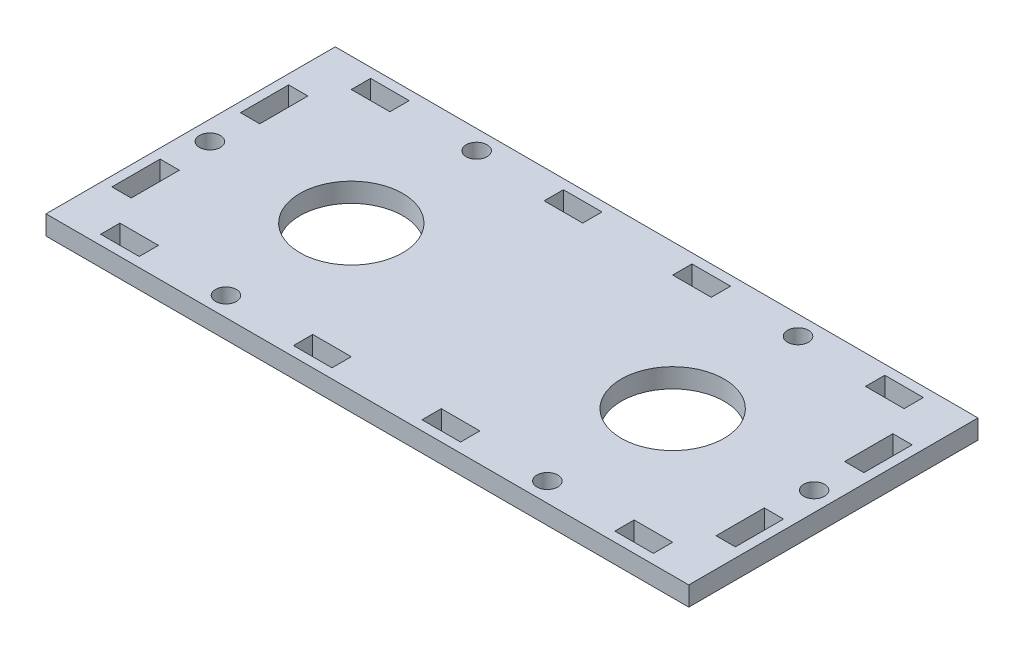
from build123d import *

# Parameters (mm, degrees)
SKETCH1_W           = 200
SKETCH1_H           = 90
BOSS_EXTRUDE1_DEPTH = 6
CUT_EXTRUDE1_REACH  = 111.823
SKETCH2_R           = 16
CUT_EXTRUDE2_REACH  = 111.823
SKETCH3_R           = 3.25
SKETCH3_W           = 12
SKETCH3_H           = 6
SKETCH3_W_2         = 6
SKETCH3_H_2         = 15


with BuildPart() as part:
    # Sketch1 → Boss-Extrude1 (new body)
    with BuildSketch(Plane(origin=(0, 0, 0), x_dir=(1, 0, 0), z_dir=(0, 1, 0))):
        Rectangle(SKETCH1_W, SKETCH1_H)
    extrude(amount=BOSS_EXTRUDE1_DEPTH)

    # Sketch2 → Cut-Extrude1 (cut, up to next)
    with BuildSketch(Plane(origin=(0, 6, 0), x_dir=(1, 0, 0), z_dir=(0, 1, 0)), mode=Mode.PRIVATE) as cut_extrude1_sk1:
        with Locations(Location((-50, 0, 0), (0, 0, 270))):
            Circle(SKETCH2_R)
    cut_extrude1_tool1 = extrude(cut_extrude1_sk1.sketch, amount=-CUT_EXTRUDE1_REACH, mode=Mode.PRIVATE) & part.part
    # Sketch2 → Cut-Extrude1 (cut, up to next)
    with BuildSketch(Plane(origin=(0, 6, 0), x_dir=(1, 0, 0), z_dir=(0, 1, 0)), mode=Mode.PRIVATE) as cut_extrude1_sk2:
        with Locations(Location((50, 0, 0), (0, 0, 270))):
            Circle(SKETCH2_R)
    cut_extrude1_tool2 = extrude(cut_extrude1_sk2.sketch, amount=-CUT_EXTRUDE1_REACH, mode=Mode.PRIVATE) & part.part
    add(cut_extrude1_tool1.solids().sort_by_distance((-50, 6, 0))[0], mode=Mode.SUBTRACT)
    add(cut_extrude1_tool2.solids().sort_by_distance((50, 6, 0))[0], mode=Mode.SUBTRACT)

    # Sketch3 → Cut-Extrude2 (cut, up to next)
    with BuildSketch(Plane(origin=(0, 6, 0), x_dir=(1, 0, 0), z_dir=(0, 1, 0)), mode=Mode.PRIVATE) as cut_extrude2_sk1:
        with Locations(Location((-50, 39, 0), (0, 0, 270))):
            Circle(SKETCH3_R)
    cut_extrude2_tool1 = extrude(cut_extrude2_sk1.sketch, amount=-CUT_EXTRUDE2_REACH, mode=Mode.PRIVATE) & part.part
    # Sketch3 → Cut-Extrude2 (cut, up to next)
    with BuildSketch(Plane(origin=(0, 6, 0), x_dir=(1, 0, 0), z_dir=(0, 1, 0)), mode=Mode.PRIVATE) as cut_extrude2_sk2:
        with Locations(Location((50, 39, 0), (0, 0, 270))):
            Circle(SKETCH3_R)
    cut_extrude2_tool2 = extrude(cut_extrude2_sk2.sketch, amount=-CUT_EXTRUDE2_REACH, mode=Mode.PRIVATE) & part.part
    # Sketch3 → Cut-Extrude2 (cut, up to next)
    with BuildSketch(Plane(origin=(0, 6, 0), x_dir=(1, 0, 0), z_dir=(0, 1, 0)), mode=Mode.PRIVATE) as cut_extrude2_sk3:
        with Locations(Location((50, -39, 0), (0, 0, 270))):
            Circle(SKETCH3_R)
    cut_extrude2_tool3 = extrude(cut_extrude2_sk3.sketch, amount=-CUT_EXTRUDE2_REACH, mode=Mode.PRIVATE) & part.part
    # Sketch3 → Cut-Extrude2 (cut, up to next)
    with BuildSketch(Plane(origin=(0, 6, 0), x_dir=(1, 0, 0), z_dir=(0, 1, 0)), mode=Mode.PRIVATE) as cut_extrude2_sk4:
        with Locations(Location((-50, -39, 0), (0, 0, 270))):
            Circle(SKETCH3_R)
    cut_extrude2_tool4 = extrude(cut_extrude2_sk4.sketch, amount=-CUT_EXTRUDE2_REACH, mode=Mode.PRIVATE) & part.part
    # Sketch3 → Cut-Extrude2 (cut, up to next)
    with BuildSketch(Plane(origin=(0, 6, 0), x_dir=(1, 0, 0), z_dir=(0, 1, 0)), mode=Mode.PRIVATE) as cut_extrude2_sk5:
        with Locations(Location((-94, 0, 0), (0, 0, 270))):
            Circle(SKETCH3_R)
    cut_extrude2_tool5 = extrude(cut_extrude2_sk5.sketch, amount=-CUT_EXTRUDE2_REACH, mode=Mode.PRIVATE) & part.part
    # Sketch3 → Cut-Extrude2 (cut, up to next)
    with BuildSketch(Plane(origin=(0, 6, 0), x_dir=(1, 0, 0), z_dir=(0, 1, 0)), mode=Mode.PRIVATE) as cut_extrude2_sk6:
        with Locations(Location((94, 0, 0), (0, 0, 270))):
            Circle(SKETCH3_R)
    cut_extrude2_tool6 = extrude(cut_extrude2_sk6.sketch, amount=-CUT_EXTRUDE2_REACH, mode=Mode.PRIVATE) & part.part
    # Sketch3 → Cut-Extrude2 (cut, up to next)
    with BuildSketch(Plane(origin=(0, 6, 0), x_dir=(1, 0, 0), z_dir=(0, 1, 0)), mode=Mode.PRIVATE) as cut_extrude2_sk7:
        with Locations((-80, 39)):
            Rectangle(SKETCH3_W, SKETCH3_H)
    cut_extrude2_tool7 = extrude(cut_extrude2_sk7.sketch, amount=-CUT_EXTRUDE2_REACH, mode=Mode.PRIVATE) & part.part
    # Sketch3 → Cut-Extrude2 (cut, up to next)
    with BuildSketch(Plane(origin=(0, 6, 0), x_dir=(1, 0, 0), z_dir=(0, 1, 0)), mode=Mode.PRIVATE) as cut_extrude2_sk8:
        with Locations((-20, 39)):
            Rectangle(SKETCH3_W, SKETCH3_H)
    cut_extrude2_tool8 = extrude(cut_extrude2_sk8.sketch, amount=-CUT_EXTRUDE2_REACH, mode=Mode.PRIVATE) & part.part
    # Sketch3 → Cut-Extrude2 (cut, up to next)
    with BuildSketch(Plane(origin=(0, 6, 0), x_dir=(1, 0, 0), z_dir=(0, 1, 0)), mode=Mode.PRIVATE) as cut_extrude2_sk9:
        with Locations((20, 39)):
            Rectangle(SKETCH3_W, SKETCH3_H)
    cut_extrude2_tool9 = extrude(cut_extrude2_sk9.sketch, amount=-CUT_EXTRUDE2_REACH, mode=Mode.PRIVATE) & part.part
    # Sketch3 → Cut-Extrude2 (cut, up to next)
    with BuildSketch(Plane(origin=(0, 6, 0), x_dir=(1, 0, 0), z_dir=(0, 1, 0)), mode=Mode.PRIVATE) as cut_extrude2_sk10:
        with Locations((80, 39)):
            Rectangle(SKETCH3_W, SKETCH3_H)
    cut_extrude2_tool10 = extrude(cut_extrude2_sk10.sketch, amount=-CUT_EXTRUDE2_REACH, mode=Mode.PRIVATE) & part.part
    # Sketch3 → Cut-Extrude2 (cut, up to next)
    with BuildSketch(Plane(origin=(0, 6, 0), x_dir=(1, 0, 0), z_dir=(0, 1, 0)), mode=Mode.PRIVATE) as cut_extrude2_sk11:
        with Locations((80, -39)):
            Rectangle(SKETCH3_W, SKETCH3_H)
    cut_extrude2_tool11 = extrude(cut_extrude2_sk11.sketch, amount=-CUT_EXTRUDE2_REACH, mode=Mode.PRIVATE) & part.part
    # Sketch3 → Cut-Extrude2 (cut, up to next)
    with BuildSketch(Plane(origin=(0, 6, 0), x_dir=(1, 0, 0), z_dir=(0, 1, 0)), mode=Mode.PRIVATE) as cut_extrude2_sk12:
        with Locations((20, -39)):
            Rectangle(SKETCH3_W, SKETCH3_H)
    cut_extrude2_tool12 = extrude(cut_extrude2_sk12.sketch, amount=-CUT_EXTRUDE2_REACH, mode=Mode.PRIVATE) & part.part
    # Sketch3 → Cut-Extrude2 (cut, up to next)
    with BuildSketch(Plane(origin=(0, 6, 0), x_dir=(1, 0, 0), z_dir=(0, 1, 0)), mode=Mode.PRIVATE) as cut_extrude2_sk13:
        with Locations((-20, -39)):
            Rectangle(SKETCH3_W, SKETCH3_H)
    cut_extrude2_tool13 = extrude(cut_extrude2_sk13.sketch, amount=-CUT_EXTRUDE2_REACH, mode=Mode.PRIVATE) & part.part
    # Sketch3 → Cut-Extrude2 (cut, up to next)
    with BuildSketch(Plane(origin=(0, 6, 0), x_dir=(1, 0, 0), z_dir=(0, 1, 0)), mode=Mode.PRIVATE) as cut_extrude2_sk14:
        with Locations((-80, -39)):
            Rectangle(SKETCH3_W, SKETCH3_H)
    cut_extrude2_tool14 = extrude(cut_extrude2_sk14.sketch, amount=-CUT_EXTRUDE2_REACH, mode=Mode.PRIVATE) & part.part
    # Sketch3 → Cut-Extrude2 (cut, up to next)
    with BuildSketch(Plane(origin=(0, 6, 0), x_dir=(1, 0, 0), z_dir=(0, 1, 0)), mode=Mode.PRIVATE) as cut_extrude2_sk15:
        with Locations((-94, 20)):
            Rectangle(SKETCH3_W_2, SKETCH3_H_2)
    cut_extrude2_tool15 = extrude(cut_extrude2_sk15.sketch, amount=-CUT_EXTRUDE2_REACH, mode=Mode.PRIVATE) & part.part
    # Sketch3 → Cut-Extrude2 (cut, up to next)
    with BuildSketch(Plane(origin=(0, 6, 0), x_dir=(1, 0, 0), z_dir=(0, 1, 0)), mode=Mode.PRIVATE) as cut_extrude2_sk16:
        with Locations((-94, -20)):
            Rectangle(SKETCH3_W_2, SKETCH3_H_2)
    cut_extrude2_tool16 = extrude(cut_extrude2_sk16.sketch, amount=-CUT_EXTRUDE2_REACH, mode=Mode.PRIVATE) & part.part
    # Sketch3 → Cut-Extrude2 (cut, up to next)
    with BuildSketch(Plane(origin=(0, 6, 0), x_dir=(1, 0, 0), z_dir=(0, 1, 0)), mode=Mode.PRIVATE) as cut_extrude2_sk17:
        with Locations((94, -20)):
            Rectangle(SKETCH3_W_2, SKETCH3_H_2)
    cut_extrude2_tool17 = extrude(cut_extrude2_sk17.sketch, amount=-CUT_EXTRUDE2_REACH, mode=Mode.PRIVATE) & part.part
    # Sketch3 → Cut-Extrude2 (cut, up to next)
    with BuildSketch(Plane(origin=(0, 6, 0), x_dir=(1, 0, 0), z_dir=(0, 1, 0)), mode=Mode.PRIVATE) as cut_extrude2_sk18:
        with Locations((94, 20)):
            Rectangle(SKETCH3_W_2, SKETCH3_H_2)
    cut_extrude2_tool18 = extrude(cut_extrude2_sk18.sketch, amount=-CUT_EXTRUDE2_REACH, mode=Mode.PRIVATE) & part.part
    add(cut_extrude2_tool1.solids().sort_by_distance((-50, 6, -39))[0], mode=Mode.SUBTRACT)
    add(cut_extrude2_tool2.solids().sort_by_distance((50, 6, -39))[0], mode=Mode.SUBTRACT)
    add(cut_extrude2_tool3.solids().sort_by_distance((50, 6, 39))[0], mode=Mode.SUBTRACT)
    add(cut_extrude2_tool4.solids().sort_by_distance((-50, 6, 39))[0], mode=Mode.SUBTRACT)
    add(cut_extrude2_tool5.solids().sort_by_distance((-94, 6, 0))[0], mode=Mode.SUBTRACT)
    add(cut_extrude2_tool6.solids().sort_by_distance((94, 6, 0))[0], mode=Mode.SUBTRACT)
    add(cut_extrude2_tool7.solids().sort_by_distance((-80, 6, -39))[0], mode=Mode.SUBTRACT)
    add(cut_extrude2_tool8.solids().sort_by_distance((-20, 6, -39))[0], mode=Mode.SUBTRACT)
    add(cut_extrude2_tool9.solids().sort_by_distance((20, 6, -39))[0], mode=Mode.SUBTRACT)
    add(cut_extrude2_tool10.solids().sort_by_distance((80, 6, -39))[0], mode=Mode.SUBTRACT)
    add(cut_extrude2_tool11.solids().sort_by_distance((80, 6, 39))[0], mode=Mode.SUBTRACT)
    add(cut_extrude2_tool12.solids().sort_by_distance((20, 6, 39))[0], mode=Mode.SUBTRACT)
    add(cut_extrude2_tool13.solids().sort_by_distance((-20, 6, 39))[0], mode=Mode.SUBTRACT)
    add(cut_extrude2_tool14.solids().sort_by_distance((-80, 6, 39))[0], mode=Mode.SUBTRACT)
    add(cut_extrude2_tool15.solids().sort_by_distance((-94, 6, -20))[0], mode=Mode.SUBTRACT)
    add(cut_extrude2_tool16.solids().sort_by_distance((-94, 6, 20))[0], mode=Mode.SUBTRACT)
    add(cut_extrude2_tool17.solids().sort_by_distance((94, 6, 20))[0], mode=Mode.SUBTRACT)
    add(cut_extrude2_tool18.solids().sort_by_distance((94, 6, -20))[0], mode=Mode.SUBTRACT)


solid = part.part
